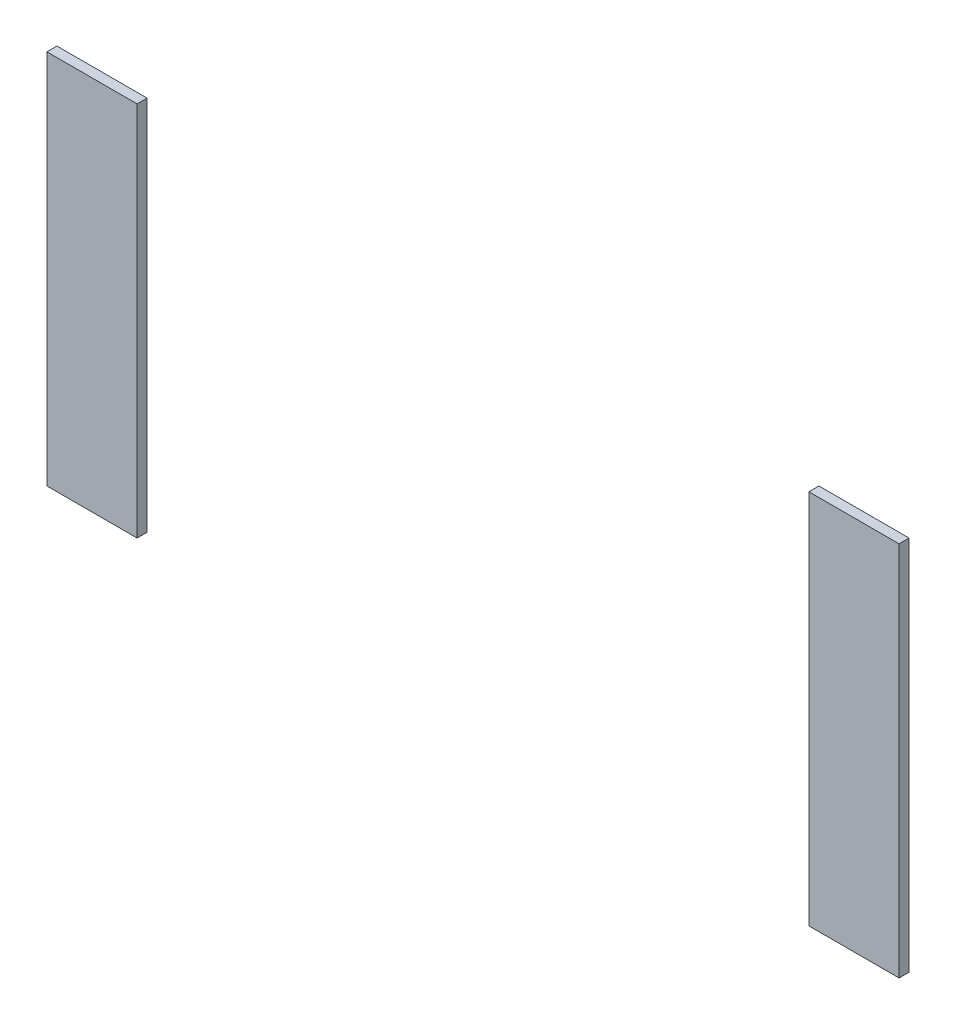
from build123d import *

# Parameters (mm, degrees)
BOSS_EXTRUDE1_DEPTH   = 10
BOSS_EXTRUDE1_2_DEPTH = 10


with BuildPart() as part:
    # Sketch1 → Boss-Extrude1 (new body)
    with BuildSketch(Plane.XY):
        Polygon((-335, 330), (-425, 330), (-425, -45), (-335, -45), (-335, 142.5), align=None)
    extrude(amount=BOSS_EXTRUDE1_DEPTH)


with BuildPart() as body_2:
    # Sketch1 → Boss-Extrude1 2 (new body)
    with BuildSketch(Plane.XY):
        Polygon((425, 330), (335, 330), (335, 142.5), (335, -45), (425, -45), align=None)
    extrude(amount=BOSS_EXTRUDE1_2_DEPTH)


solid = Compound([part.part, body_2.part])
